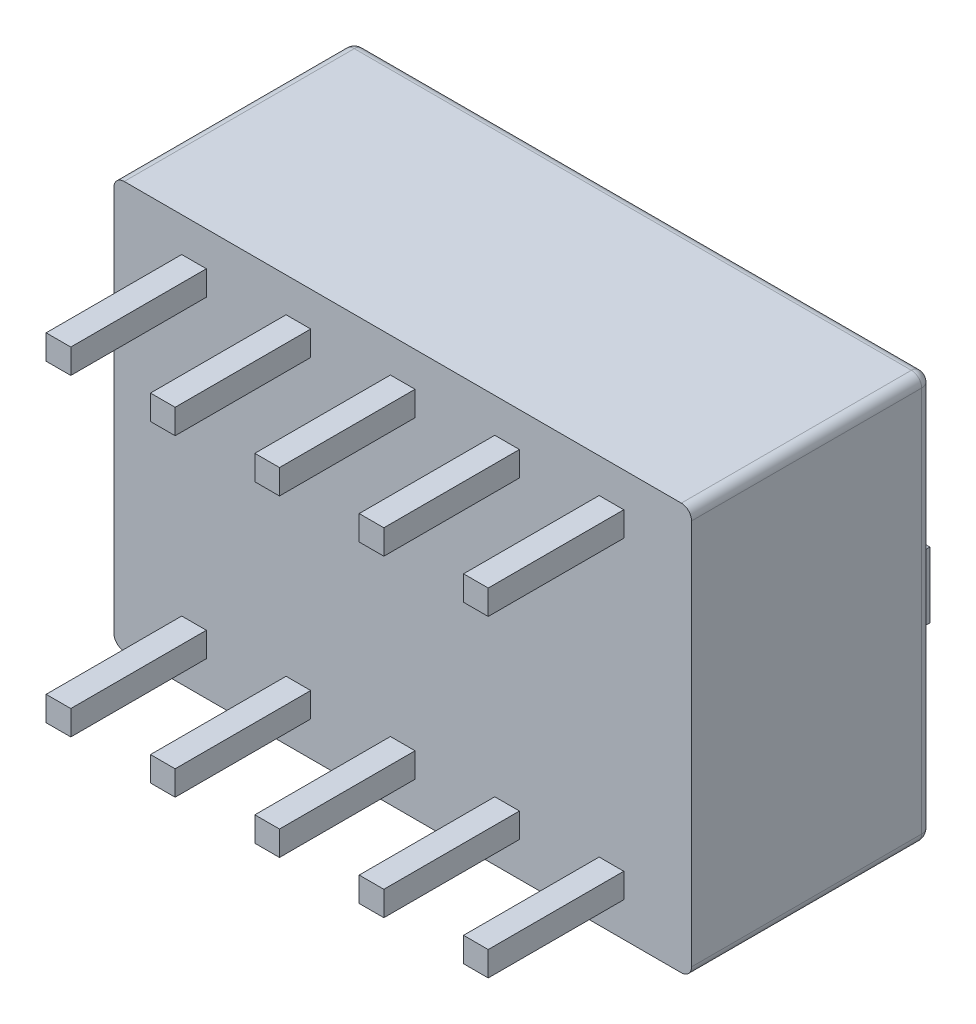
from build123d import *

# Parameters (mm, degrees)
IZIM1_W                       = 14.06
IZIM1_H                       = 9.9
Y_KSEKLIK_EKSTR_ZYON1_DEPTH   = 5.85
IZIM2_W                       = 1.4
IZIM2_H                       = 3.2
KES_EKSTR_ZYON1_DEPTH         = 1
IZIM3_W                       = 1.4
IZIM3_H                       = 1.6
Y_KSEKLIK_EKSTR_ZYON2_DEPTH   = 2.2
Y_KSEKLIK_EKSTR_ZYON2_2_DEPTH = 2.2
Y_KSEKLIK_EKSTR_ZYON2_3_DEPTH = 2.2
Y_KSEKLIK_EKSTR_ZYON2_4_DEPTH = 2.2
Y_KSEKLIK_EKSTR_ZYON2_5_DEPTH = 2.2
IZIM4_W                       = 1.4
IZIM4_H                       = 1.6
Y_KSEKLIK_EKSTR_ZYON3_DEPTH   = 0.9
Y_KSEKLIK_EKSTR_ZYON3_2_DEPTH = 0.9
Y_KSEKLIK_EKSTR_ZYON3_3_DEPTH = 0.9
Y_KSEKLIK_EKSTR_ZYON3_4_DEPTH = 0.9
Y_KSEKLIK_EKSTR_ZYON3_5_DEPTH = 0.9
RADYUS1_R                     = 0.25
IZIM5_W                       = 0.6
IZIM5_H                       = 0.6
Y_KSEKLIK_EKSTR_ZYON4_DEPTH   = 3.3


with BuildPart() as part:
    # Çizim1 → Yükseklik-Ekstrüzyon1 (new body)
    with BuildSketch(Plane.XY):
        Rectangle(IZIM1_W, IZIM1_H)
    extrude(amount=Y_KSEKLIK_EKSTR_ZYON1_DEPTH)

    # Çizim2 → Kes-Ekstrüzyon1 (cut)
    with BuildSketch(Plane(origin=(0, 0, 0), x_dir=(-1, 0, 0), z_dir=(0, 0, -1))):
        with Locations((-5.08, 0)):
            Rectangle(IZIM2_W, IZIM2_H)
        with Locations((-2.54, 0)):
            Rectangle(IZIM2_W, IZIM2_H)
        Rectangle(IZIM2_W, IZIM2_H)
        with Locations((2.54, 0)):
            Rectangle(IZIM2_W, IZIM2_H)
        with Locations((5.08, 0)):
            Rectangle(IZIM2_W, IZIM2_H)
    extrude(amount=-KES_EKSTR_ZYON1_DEPTH, mode=Mode.SUBTRACT)

    # Radyus1
    radyus1_edges = [part.edges().sort_by_distance(p)[0] for p in [
        (0, -4.95, 0),
        (-7.03, 0, 0),
        (0, 4.95, 0),
        (7.03, 0, 0),
        (7.03, -4.95, 2.925),
        (-7.03, -4.95, 2.925),
        (-7.03, 4.95, 2.925),
        (7.03, 4.95, 2.925),
    ]]
    fillet(radyus1_edges, radius=RADYUS1_R)

    # Çizim5 → Yükseklik-Ekstrüzyon4 (add)
    with BuildSketch(Plane.XY.offset(5.85)):
        with Locations((-5.08, -3.81)):
            Rectangle(IZIM5_W, IZIM5_H)
        with Locations((-5.08, 3.81)):
            Rectangle(IZIM5_W, IZIM5_H)
        with Locations((-2.54, -3.81)):
            Rectangle(IZIM5_W, IZIM5_H)
        with Locations((-2.54, 3.81)):
            Rectangle(IZIM5_W, IZIM5_H)
        with Locations((0, 3.81)):
            Rectangle(IZIM5_W, IZIM5_H)
        with Locations((0, -3.81)):
            Rectangle(IZIM5_W, IZIM5_H)
        with Locations((2.54, -3.81)):
            Rectangle(IZIM5_W, IZIM5_H)
        with Locations((2.54, 3.81)):
            Rectangle(IZIM5_W, IZIM5_H)
        with Locations((5.08, -3.81)):
            Rectangle(IZIM5_W, IZIM5_H)
        with Locations((5.08, 3.81)):
            Rectangle(IZIM5_W, IZIM5_H)
    extrude(amount=Y_KSEKLIK_EKSTR_ZYON4_DEPTH)


with BuildPart() as body_2:
    # Çizim3 → Yükseklik-Ekstrüzyon2 (new body)
    with BuildSketch(Plane(origin=(0, 0, 1), x_dir=(-1, 0, 0), z_dir=(0, 0, -1))):
        with Locations((-5.08, -0.8)):
            Rectangle(IZIM3_W, IZIM3_H)
    extrude(amount=Y_KSEKLIK_EKSTR_ZYON2_DEPTH)


with BuildPart() as body_3:
    # Çizim3 → Y_kseklik-Ekstr_zyon2 2 (new body)
    with BuildSketch(Plane(origin=(0, 0, 1), x_dir=(-1, 0, 0), z_dir=(0, 0, -1))):
        with Locations((-2.54, -0.8)):
            Rectangle(IZIM3_W, IZIM3_H)
    extrude(amount=Y_KSEKLIK_EKSTR_ZYON2_2_DEPTH)


with BuildPart() as body_4:
    # Çizim3 → Y_kseklik-Ekstr_zyon2 3 (new body)
    with BuildSketch(Plane(origin=(0, 0, 1), x_dir=(-1, 0, 0), z_dir=(0, 0, -1))):
        with Locations((0, -0.8)):
            Rectangle(IZIM3_W, IZIM3_H)
    extrude(amount=Y_KSEKLIK_EKSTR_ZYON2_3_DEPTH)


with BuildPart() as body_5:
    # Çizim3 → Y_kseklik-Ekstr_zyon2 4 (new body)
    with BuildSketch(Plane(origin=(0, 0, 1), x_dir=(-1, 0, 0), z_dir=(0, 0, -1))):
        with Locations((2.54, -0.8)):
            Rectangle(IZIM3_W, IZIM3_H)
    extrude(amount=Y_KSEKLIK_EKSTR_ZYON2_4_DEPTH)


with BuildPart() as body_6:
    # Çizim3 → Y_kseklik-Ekstr_zyon2 5 (new body)
    with BuildSketch(Plane(origin=(0, 0, 1), x_dir=(-1, 0, 0), z_dir=(0, 0, -1))):
        with Locations((5.08, -0.8)):
            Rectangle(IZIM3_W, IZIM3_H)
    extrude(amount=Y_KSEKLIK_EKSTR_ZYON2_5_DEPTH)


with BuildPart() as body_7:
    # Çizim4 → Yükseklik-Ekstrüzyon3 (new body)
    with BuildSketch(Plane(origin=(0, 0, 1), x_dir=(-1, 0, 0), z_dir=(0, 0, -1))):
        with Locations((-5.08, 0.8)):
            Rectangle(IZIM4_W, IZIM4_H)
    extrude(amount=Y_KSEKLIK_EKSTR_ZYON3_DEPTH)


with BuildPart() as body_8:
    # Çizim4 → Y_kseklik-Ekstr_zyon3 2 (new body)
    with BuildSketch(Plane(origin=(0, 0, 1), x_dir=(-1, 0, 0), z_dir=(0, 0, -1))):
        with Locations((-2.54, 0.8)):
            Rectangle(IZIM4_W, IZIM4_H)
    extrude(amount=Y_KSEKLIK_EKSTR_ZYON3_2_DEPTH)


with BuildPart() as body_9:
    # Çizim4 → Y_kseklik-Ekstr_zyon3 3 (new body)
    with BuildSketch(Plane(origin=(0, 0, 1), x_dir=(-1, 0, 0), z_dir=(0, 0, -1))):
        with Locations((0, 0.8)):
            Rectangle(IZIM4_W, IZIM4_H)
    extrude(amount=Y_KSEKLIK_EKSTR_ZYON3_3_DEPTH)


with BuildPart() as body_10:
    # Çizim4 → Y_kseklik-Ekstr_zyon3 4 (new body)
    with BuildSketch(Plane(origin=(0, 0, 1), x_dir=(-1, 0, 0), z_dir=(0, 0, -1))):
        with Locations((2.54, 0.8)):
            Rectangle(IZIM4_W, IZIM4_H)
    extrude(amount=Y_KSEKLIK_EKSTR_ZYON3_4_DEPTH)


with BuildPart() as body_11:
    # Çizim4 → Y_kseklik-Ekstr_zyon3 5 (new body)
    with BuildSketch(Plane(origin=(0, 0, 1), x_dir=(-1, 0, 0), z_dir=(0, 0, -1))):
        with Locations((5.08, 0.8)):
            Rectangle(IZIM4_W, IZIM4_H)
    extrude(amount=Y_KSEKLIK_EKSTR_ZYON3_5_DEPTH)


solid = Compound([part.part, body_2.part, body_3.part, body_4.part, body_5.part, body_6.part, body_7.part, body_8.part, body_9.part, body_10.part, body_11.part])
